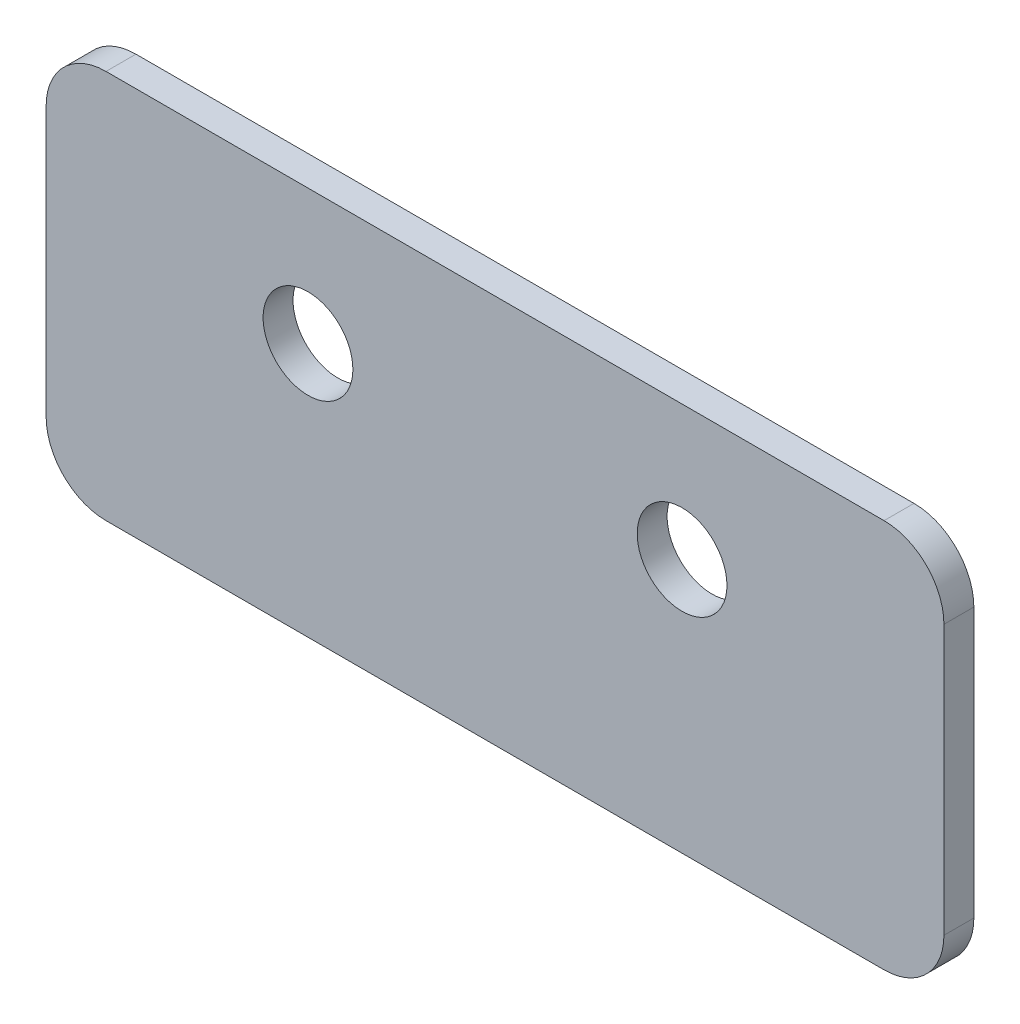
from build123d import *

# Parameters (mm, degrees)
ESQUISSE1_R        = 1.5
BOSS_EXTRU_1_DEPTH = 1


with BuildPart() as part:
    # Esquisse1 → Boss.-Extru.1 (new body)
    with BuildSketch(Plane.XY):
        with BuildLine():
            Line((-13, 4.5), (13, 4.5))
            ThreePointArc((13, 4.5), (14.414213562, 3.914213562), (15, 2.5))
            Line((15, 2.5), (15, -6.5))
            ThreePointArc((15, -6.5), (14.414213562, -7.914213562), (13, -8.5))
            Line((13, -8.5), (-13, -8.5))
            ThreePointArc((-13, -8.5), (-14.414213562, -7.914213562), (-15, -6.5))
            Line((-15, -6.5), (-15, 2.5))
            ThreePointArc((-15, 2.5), (-14.414213562, 3.914213562), (-13, 4.5))
        make_face()
        with Locations((-6.25, 0)):
            Circle(ESQUISSE1_R, mode=Mode.SUBTRACT)
        with Locations((6.25, 0)):
            Circle(ESQUISSE1_R, mode=Mode.SUBTRACT)
    extrude(amount=BOSS_EXTRU_1_DEPTH)


solid = part.part
